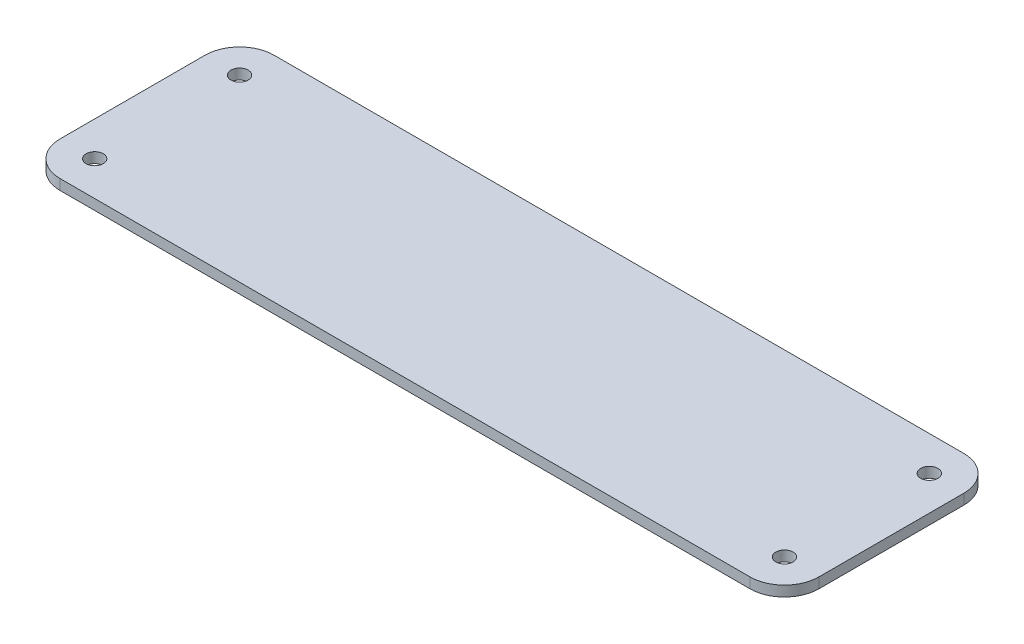
from build123d import *

# Parameters (mm, degrees)
SKETCH1_R           = 2.5
BOSS_EXTRUDE1_DEPTH = 3


with BuildPart() as part:
    # Sketch1 → Boss-Extrude1 (new body)
    with BuildSketch(Plane(origin=(0, 0, 0), x_dir=(1, 0, 0), z_dir=(0, 1, 0))):
        with BuildLine():
            Line((-100, 62), (100, 62))
            ThreePointArc((100, 62), (107.071067812, 59.071067812), (110, 52))
            Line((110, 52), (110, 10))
            ThreePointArc((110, 10), (107.071067812, 2.928932188), (100, 0))
            Line((100, 0), (-100, 0))
            ThreePointArc((-100, 0), (-107.071067812, 2.928932188), (-110, 10))
            Line((-110, 10), (-110, 52))
            ThreePointArc((-110, 52), (-107.071067812, 59.071067812), (-100, 62))
        make_face()
        with Locations(Location((-100, 52, 0), (0, 0, 270))):
            Circle(SKETCH1_R, mode=Mode.SUBTRACT)
        with Locations(Location((-100, 10, 0), (0, 0, 270))):
            Circle(SKETCH1_R, mode=Mode.SUBTRACT)
        with Locations(Location((100, 52, 0), (0, 0, 90))):
            Circle(SKETCH1_R, mode=Mode.SUBTRACT)
        with Locations(Location((100, 10, 0), (0, 0, 90))):
            Circle(SKETCH1_R, mode=Mode.SUBTRACT)
    extrude(amount=BOSS_EXTRUDE1_DEPTH)


solid = part.part
